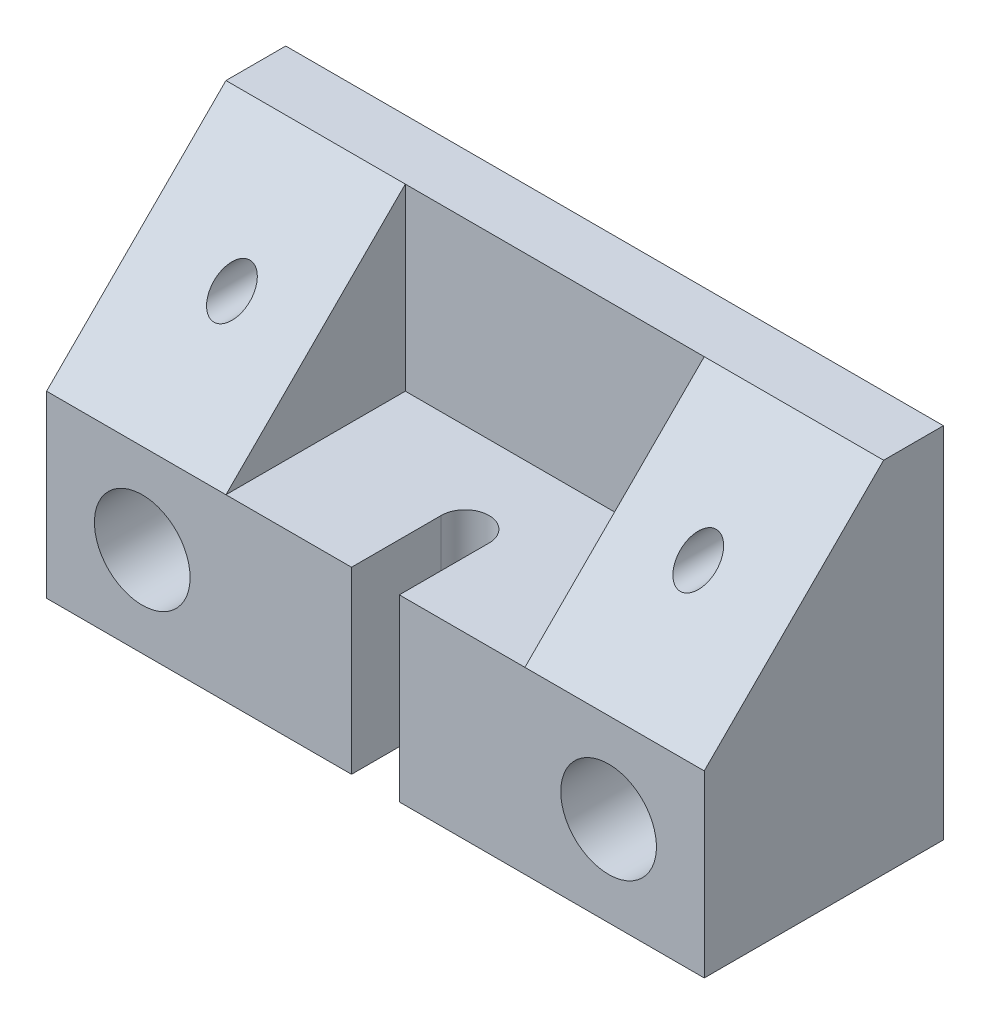
from build123d import *

# Parameters (mm, degrees)
SKETCH_1_W          = 0.55
SKETCH_1_H          = 0.3
EXTRUDE_1_DEPTH     = 0.2
CUT_EXTRUDE_1_REACH = 2.658
SKETCH_3_W          = 0.25
SKETCH_3_H          = 0.15
CUT_EXTRUDE_2_DEPTH = 0.15
CUT_EXTRUDE_3_DEPTH = 1.604152299
SKETCH_5_R          = 0.04
SKETCH_5_R_2        = 0.015
CUT_EXTRUDE_4_DEPTH = 1.657647322


with BuildPart() as part:
    # 草图1 → 凸台-拉伸1 (new body)
    with BuildSketch(Plane.XY):
        with Locations((0.275, 0.15)):
            Rectangle(SKETCH_1_W, SKETCH_1_H)
    extrude(amount=EXTRUDE_1_DEPTH)

    # 草图2 → 切除-拉伸1 (cut, up to next)
    with BuildSketch(Plane.ZY, mode=Mode.PRIVATE) as cut_extrude_1_sk1:
        Polygon((0.2, 0.3), (0.2, 0.15), (0.05, 0.3), align=None)
    cut_extrude_1_tool1 = extrude(cut_extrude_1_sk1.sketch, amount=-CUT_EXTRUDE_1_REACH, mode=Mode.PRIVATE) & part.part
    add(cut_extrude_1_tool1.solids().sort_by_distance((0, 0.25, 0.15))[0], mode=Mode.SUBTRACT)

    # 草图3 → 切除-拉伸2 (cut)
    with BuildSketch(Plane(origin=(0, 0.3, 0), x_dir=(1, 0, 0), z_dir=(0, 1, 0))):
        with Locations((0.275, -0.125)):
            Rectangle(SKETCH_3_W, SKETCH_3_H)
    extrude(amount=-CUT_EXTRUDE_2_DEPTH, mode=Mode.SUBTRACT)

    # 草图4 → 切除-拉伸3 (cut, through all)
    with BuildSketch(Plane(origin=(0, 0.15, 0), x_dir=(1, 0, 0), z_dir=(0, 1, 0))):
        with BuildLine():
            Line((0.255, -0.275), (0.255, -0.125))
            ThreePointArc((0.255, -0.125), (0.275, -0.105), (0.295, -0.125))
            Line((0.295, -0.125), (0.295, -0.275))
            ThreePointArc((0.295, -0.275), (0.275, -0.295), (0.255, -0.275))
        make_face()
    extrude(amount=-CUT_EXTRUDE_3_DEPTH, mode=Mode.SUBTRACT)

    # 草图5 → 切除-拉伸4 (cut, through all)
    with BuildSketch(Plane.XY.offset(0.2)):
        with Locations((0.08, 0.075)):
            Circle(SKETCH_5_R)
        with Locations((0.08, 0.225)):
            Circle(SKETCH_5_R_2)
        with Locations(Location((0.47, 0.075, 0), (0, 0, 180))):
            Circle(SKETCH_5_R)
        with Locations(Location((0.47, 0.225, 0), (0, 0, 270))):
            Circle(SKETCH_5_R_2)
    extrude(amount=-CUT_EXTRUDE_4_DEPTH, mode=Mode.SUBTRACT)


solid = part.part
